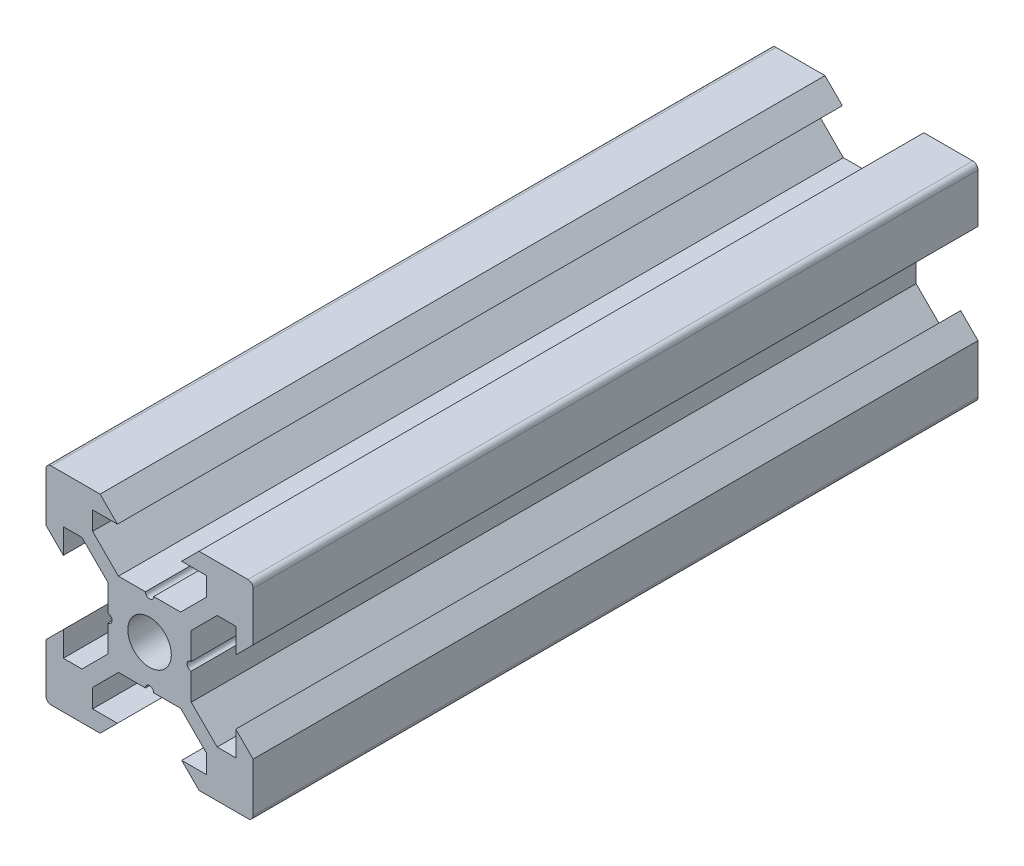
from build123d import *

# Parameters (mm, degrees)
SKETCH1_R           = 2.1
BOSS_EXTRUDE1_DEPTH = 70
FILLET1_R           = 0.5
CUT_EXTRUDE1_DEPTH  = 72.414284285


with BuildPart() as part:
    # Sketch1 → Boss-Extrude1 (new body)
    with BuildSketch(Plane.XY):
        Polygon((-10, 10), (-4.775, 10), (-3.1, 8.325), (-5.5, 8.325), (-5.5, 6.525), (-3, 4.025), (3, 4.025), (5.5, 6.525), (5.5, 8.325), (3.1, 8.325), (4.775, 10), (10, 10), (10, 4.775), (8.325, 3.1), (8.325, 5.5), (6.525, 5.5), (4.025, 3), (4.025, -3), (6.525, -5.5), (8.325, -5.5), (8.325, -3.1), (10, -4.775), (10, -10), (4.775, -10), (3.1, -8.325), (5.5, -8.325), (5.5, -6.525), (3, -4.025), (-3, -4.025), (-5.5, -6.525), (-5.5, -8.325), (-3.1, -8.325), (-4.775, -10), (-10, -10), (-10, -4.775), (-8.325, -3.1), (-8.325, -5.5), (-6.525, -5.5), (-4.025, -3), (-4.025, 3), (-6.525, 5.5), (-8.325, 5.5), (-8.325, 3.1), (-10, 4.775), align=None)
        Circle(SKETCH1_R, mode=Mode.SUBTRACT)
    extrude(amount=BOSS_EXTRUDE1_DEPTH)

    # Fillet1
    fillet1_edges = [part.edges().sort_by_distance(p)[0] for p in [
        (10, -10, 35),
        (-10, -10, 35),
        (-10, 10, 35),
        (10, 10, 35),
    ]]
    fillet(fillet1_edges, radius=FILLET1_R)

    # Sketch2 → Cut-Extrude1 (cut, through all)
    with BuildSketch(Plane.XY.offset(70)):
        with BuildLine():
            ThreePointArc((-4.025, 0.4), (-4.425, 0), (-4.025, -0.4))
            Line((-4.025, -0.4), (-4.025, 0.4))
        make_face()
        with BuildLine():
            Line((-4.025, 0.4), (-4.025, -0.4))
            ThreePointArc((-4.025, -0.4), (-3.742157288, -0.282842712), (-3.625, 0))
            ThreePointArc((-3.625, 0), (-3.742157288, 0.282842712), (-4.025, 0.4))
        make_face()
        with BuildLine():
            ThreePointArc((0.4, 4.025), (0, 4.425), (-0.4, 4.025))
            Line((-0.4, 4.025), (0.4, 4.025))
        make_face()
        with BuildLine():
            Line((0.4, 4.025), (-0.4, 4.025))
            ThreePointArc((-0.4, 4.025), (0, 3.625), (0.4, 4.025))
        make_face()
        with BuildLine():
            ThreePointArc((4.025, 0.4), (3.625, 0), (4.025, -0.4))
            Line((4.025, -0.4), (4.025, 0.4))
        make_face()
        with BuildLine():
            Line((4.025, 0.4), (4.025, -0.4))
            ThreePointArc((4.025, -0.4), (4.307842712, -0.282842712), (4.425, 0))
            ThreePointArc((4.425, 0), (4.307842712, 0.282842712), (4.025, 0.4))
        make_face()
        with BuildLine():
            ThreePointArc((0.4, -4.025), (0, -3.625), (-0.4, -4.025))
            Line((-0.4, -4.025), (0.4, -4.025))
        make_face()
        with BuildLine():
            Line((0.4, -4.025), (-0.4, -4.025))
            ThreePointArc((-0.4, -4.025), (0, -4.425), (0.4, -4.025))
        make_face()
    extrude(amount=-CUT_EXTRUDE1_DEPTH, mode=Mode.SUBTRACT)


solid = part.part
